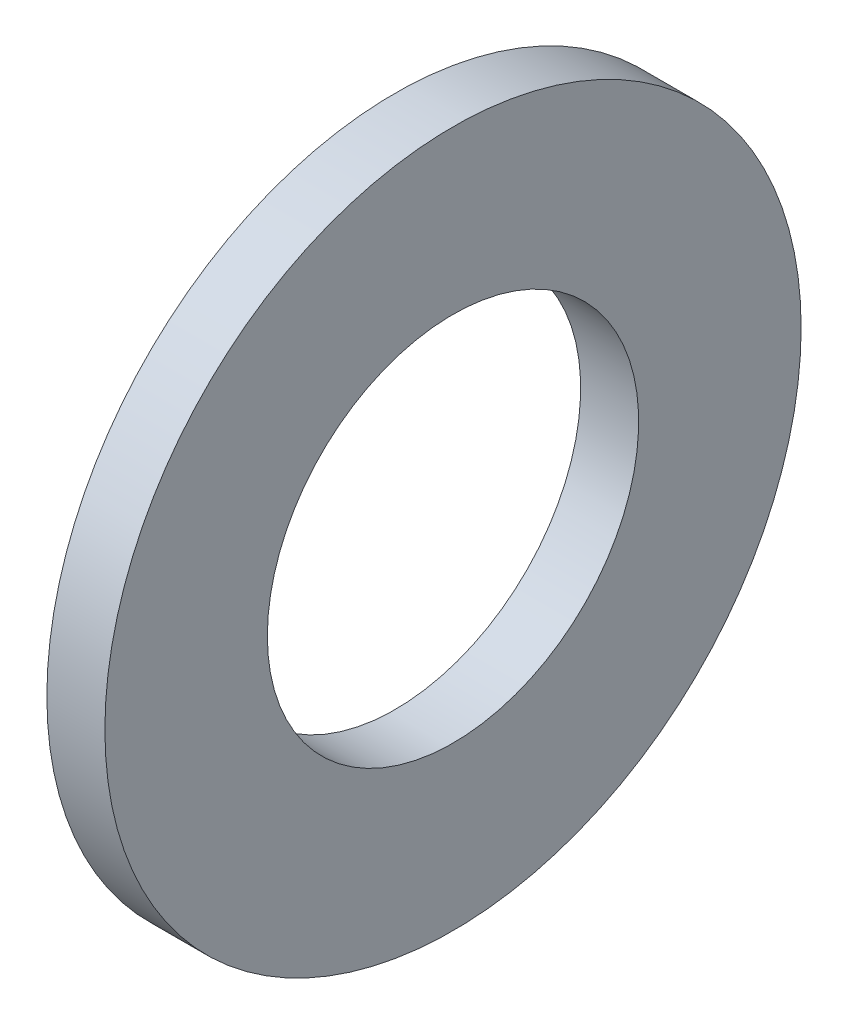
from build123d import *

# Parameters (mm, degrees)
SKETCH1_W = 1
SKETCH1_H = 2.8


with BuildPart() as part:
    # Sketch1 → Base-Revolve (revolve)
    with BuildSketch(Plane.XY, mode=Mode.PRIVATE) as base_revolve_sk:
        with Locations((-0.5, 4.6)):
            Rectangle(SKETCH1_W, SKETCH1_H)
    revolve(base_revolve_sk.sketch.rotate(Axis((-34.925, 0, 0), (1, 0, 0)), 90), axis=Axis((-34.925, 0, 0), (1, 0, 0)))


solid = part.part
